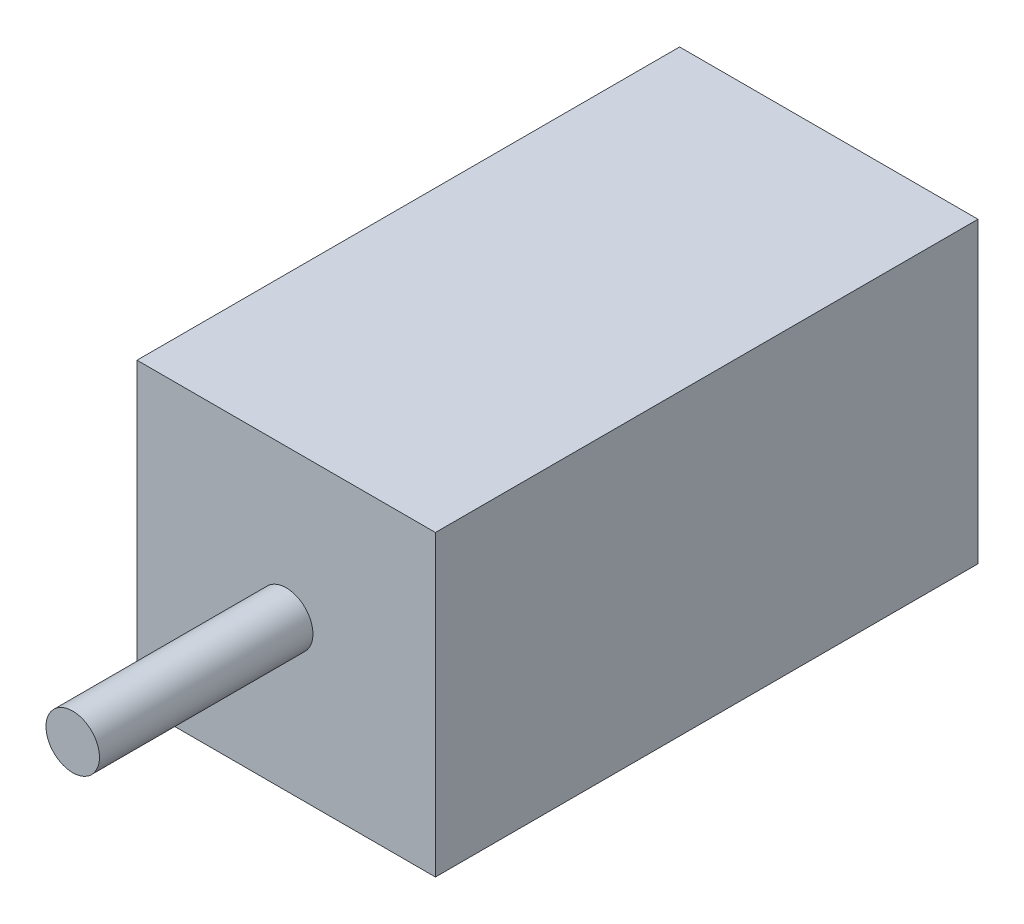
from build123d import *

# Parameters (mm, degrees)
SKETCH1_W           = 27.94
SKETCH1_H           = 27.94
BOSS_EXTRUDE1_DEPTH = 50.8
SKETCH2_R           = 2.5019
BOSS_EXTRUDE2_DEPTH = 19.9898


with BuildPart() as part:
    # Sketch1 → Boss-Extrude1 (new body)
    with BuildSketch(Plane.XY):
        Rectangle(SKETCH1_W, SKETCH1_H)
    extrude(amount=BOSS_EXTRUDE1_DEPTH)

    # Sketch2 → Boss-Extrude2 (add)
    with BuildSketch(Plane.XY.offset(50.8)):
        with Locations(Location((0, 0, 0), (0, 0, 180))):
            Circle(SKETCH2_R)
    extrude(amount=BOSS_EXTRUDE2_DEPTH)


solid = part.part
